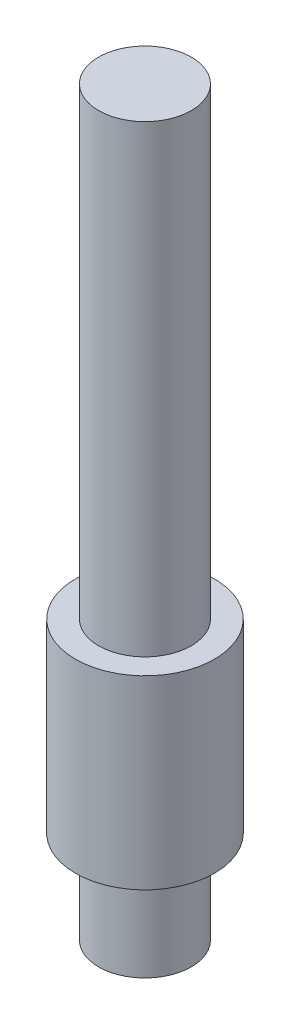
from build123d import *


with BuildPart() as part:
    # Sketch1 → Revolve1 (revolve)
    with BuildSketch(Plane.XY, mode=Mode.PRIVATE) as revolve1_sk:
        Polygon((15, 60), (15, 20), (10, 20), (10, 0), (0, 0), (0, 160), (10, 160), (10, 60), align=None)
    revolve(revolve1_sk.sketch.rotate(Axis((0, 39.987949733, 0), (0, -1, 0)), 90), axis=Axis((0, 39.987949733, 0), (0, -1, 0)))


solid = part.part
